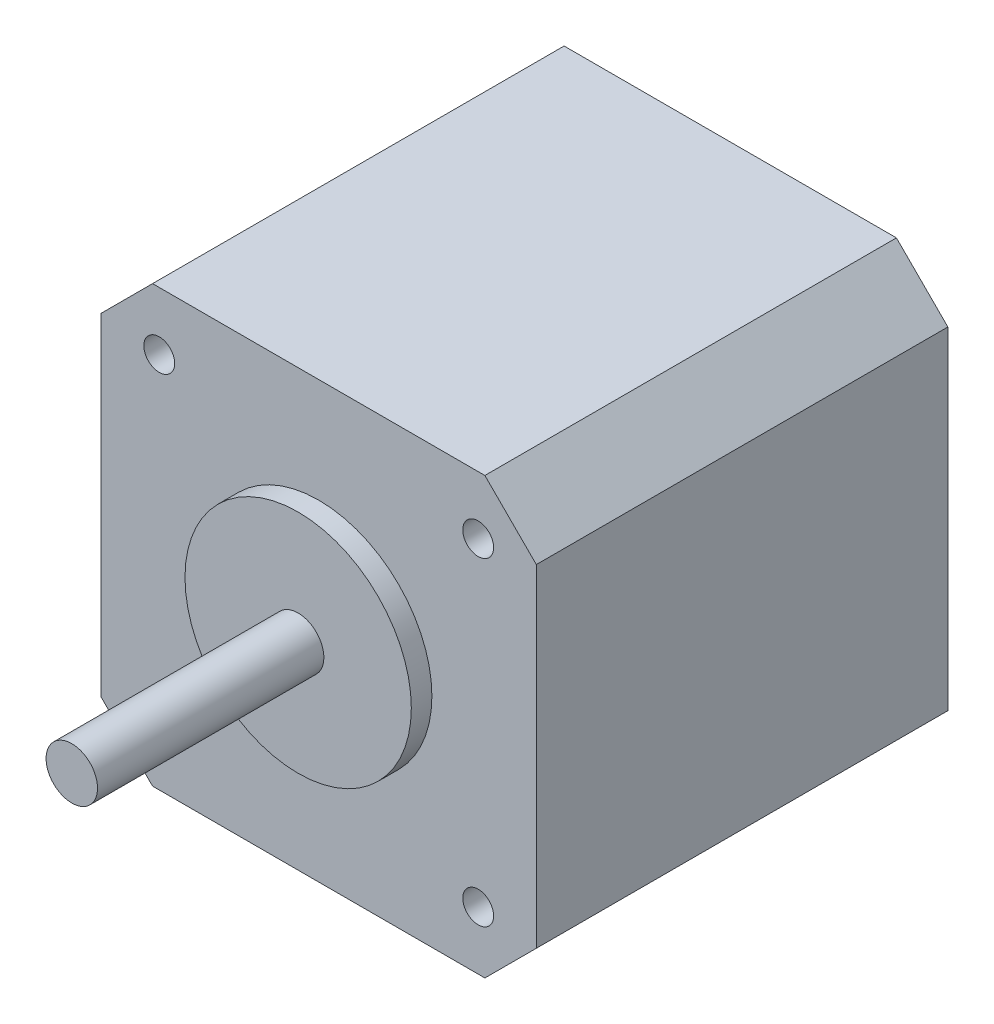
from build123d import *

# Parameters (mm, degrees)
SKETCH1_W           = 42.3
SKETCH1_H           = 42.3
BOSS_EXTRUDE1_DEPTH = 40
SKETCH2_R           = 11
BOSS_EXTRUDE2_DEPTH = 2
SKETCH3_R           = 2.5
BOSS_EXTRUDE3_DEPTH = 22
SKETCH4_R           = 1.5
CUT_EXTRUDE1_DEPTH  = 4.5
CHAMFER1_SIZE       = 5
SKETCH5_W           = 5
SKETCH5_H           = 5
BOSS_EXTRUDE4_DEPTH = 1


with BuildPart() as part:
    # Sketch1 → Boss-Extrude1 (new body)
    with BuildSketch(Plane.XY):
        Rectangle(SKETCH1_W, SKETCH1_H)
    extrude(amount=-BOSS_EXTRUDE1_DEPTH)

    # Sketch2 → Boss-Extrude2 (add)
    with BuildSketch(Plane.XY):
        with Locations(Location((0, 0, 0), (0, 0, 180))):
            Circle(SKETCH2_R)
    extrude(amount=BOSS_EXTRUDE2_DEPTH)

    # Sketch3 → Boss-Extrude3 (add)
    with BuildSketch(Plane.XY.offset(2)):
        Circle(SKETCH3_R)
    extrude(amount=BOSS_EXTRUDE3_DEPTH)

    # Sketch4 → Cut-Extrude1 (cut)
    with BuildSketch(Plane.XY):
        with Locations((-15.5, 15.5)):
            Circle(SKETCH4_R)
        with Locations((15.5, 15.5)):
            Circle(SKETCH4_R)
        with Locations((15.5, -15.5)):
            Circle(SKETCH4_R)
        with Locations((-15.5, -15.5)):
            Circle(SKETCH4_R)
    extrude(amount=-CUT_EXTRUDE1_DEPTH, mode=Mode.SUBTRACT)

    # Chamfer1
    chamfer1_edges = [part.edges().sort_by_distance(p)[0] for p in [
        (-21.15, 21.15, -20),
        (21.15, 21.15, -20),
        (21.15, -21.15, -20),
        (-21.15, -21.15, -20),
    ]]
    chamfer(chamfer1_edges, length=CHAMFER1_SIZE)

    # Sketch5 → Boss-Extrude4 (add)
    with BuildSketch(Plane.XZ.offset(21.15)):
        with Locations((0, -34.5)):
            Rectangle(SKETCH5_W, SKETCH5_H)
    extrude(amount=BOSS_EXTRUDE4_DEPTH)


solid = part.part
